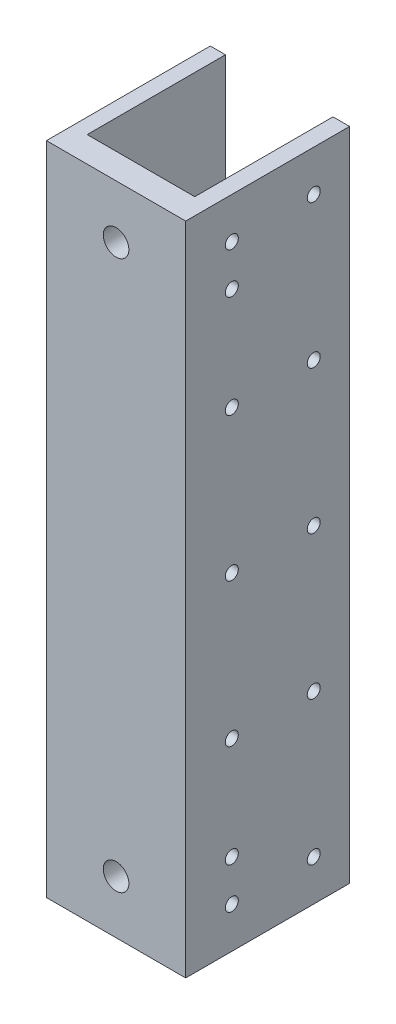
from build123d import *

# Parameters (mm, degrees)
SKETCH1_W                  = 43.18
SKETCH1_H                  = 203.2
BOSS_EXTRUDE1_DEPTH        = 50.8
F_3_8_16_TAPPED_HOLE1_D    = 7.9375
F_10_32_TAPPED_HOLE1_D     = 4.0386
SKETCH9_W                  = 33.3375
SKETCH9_H                  = 50.596782444
CUT_EXTRUDE1_DEPTH         = 214.858346575
F_10_32_TAPPED_HOLE2_D     = 4.0386
F_10_32_TAPPED_HOLE2_DEPTH = 17.78
F_10_32_TAPPED_HOLE2_TIP   = 1.213317848
F_10_32_TAPPED_HOLE3_D     = 4.0386
F_10_32_TAPPED_HOLE3_DEPTH = 17.78
F_10_32_TAPPED_HOLE3_TIP   = 1.213317848


with BuildPart() as part:
    # Sketch1 → Boss-Extrude1 (new body)
    with BuildSketch(Plane.XY):
        with Locations((-21.59, 23.319966314)):
            Rectangle(SKETCH1_W, SKETCH1_H)
    extrude(amount=BOSS_EXTRUDE1_DEPTH)

    # 3/8-16 Tapped Hole1 (through all)
    with Locations(Plane.XY.offset(50.8)):
        with Locations((-21.59, 108.409966314), (-21.59, -61.770033686)):
            Hole(F_3_8_16_TAPPED_HOLE1_D / 2)

    # #10-32 Tapped Hole1 (through all)
    with Locations(Plane(origin=(0, 0, 0), x_dir=(0, 0, -1), z_dir=(1, 0, 0))):
        with Locations((-36.5125, 99.519966314), (-36.5125, 23.319966314), (-36.5125, -52.880033686)):
            Hole(F_10_32_TAPPED_HOLE1_D / 2)

    # Sketch9 → Cut-Extrude1 (cut, through all)
    with BuildSketch(Plane(origin=(0, 124.919966314, 0), x_dir=(1, 0, 0), z_dir=(0, 1, 0))):
        with Locations((-21.81225, -17.564108778)):
            Rectangle(SKETCH9_W, SKETCH9_H)
    extrude(amount=-CUT_EXTRUDE1_DEPTH, mode=Mode.SUBTRACT)

    # #10-32 Tapped Hole2
    with Locations(Plane(origin=(3.175, 53.792091732, -9.087092082), x_dir=(0, 0, -1), z_dir=(1, 0, 0))):
        with Locations((284.600407918, 58.427874582), (310.000407918, 58.427874582), (284.600407918, 13.977874582), (310.000407918, 13.977874582), (284.600407918, -30.472125418), (284.600407918, -74.922125418), (310.000407918, -74.922125418), (284.600407918, -119.372125418), (310.000407918, -119.372125418), (-20.199592082, 58.427874582), (-45.599592082, 58.427874582), (-20.199592082, 13.977874582), (-45.599592082, 13.977874582), (-20.199592082, -30.472125418), (-20.199592082, -74.922125418), (-45.599592082, -74.922125418), (-45.599592082, -119.372125418), (-20.199592082, -119.372125418)):
            Hole(F_10_32_TAPPED_HOLE2_D / 2, depth=F_10_32_TAPPED_HOLE2_DEPTH)
            with Locations((0, 0, -(F_10_32_TAPPED_HOLE2_DEPTH + F_10_32_TAPPED_HOLE2_TIP / 2))):  # 118° drill point
                Cone(0, F_10_32_TAPPED_HOLE2_D / 2, F_10_32_TAPPED_HOLE2_TIP, mode=Mode.SUBTRACT)

    # #10-32 Tapped Hole3
    with Locations(Plane(origin=(3.175, -7.152159104, -273.487907918), x_dir=(0, 0, 1), z_dir=(1, 0, 0))):
        with Locations((284.600407918, 58.427874582), (310.000407918, 58.427874582), (284.600407918, 13.977874582), (310.000407918, 13.977874582), (284.600407918, -30.472125418), (284.600407918, -74.922125418), (310.000407918, -74.922125418), (284.600407918, -119.372125418), (310.000407918, -119.372125418), (-20.199592082, 58.427874582), (-45.599592082, 58.427874582), (-20.199592082, 13.977874582), (-45.599592082, 13.977874582), (-20.199592082, -30.472125418), (-20.199592082, -74.922125418), (-45.599592082, -74.922125418), (-45.599592082, -119.372125418), (-20.199592082, -119.372125418)):
            Hole(F_10_32_TAPPED_HOLE3_D / 2, depth=F_10_32_TAPPED_HOLE3_DEPTH)
            with Locations((0, 0, -(F_10_32_TAPPED_HOLE3_DEPTH + F_10_32_TAPPED_HOLE3_TIP / 2))):  # 118° drill point
                Cone(0, F_10_32_TAPPED_HOLE3_D / 2, F_10_32_TAPPED_HOLE3_TIP, mode=Mode.SUBTRACT)


solid = part.part
